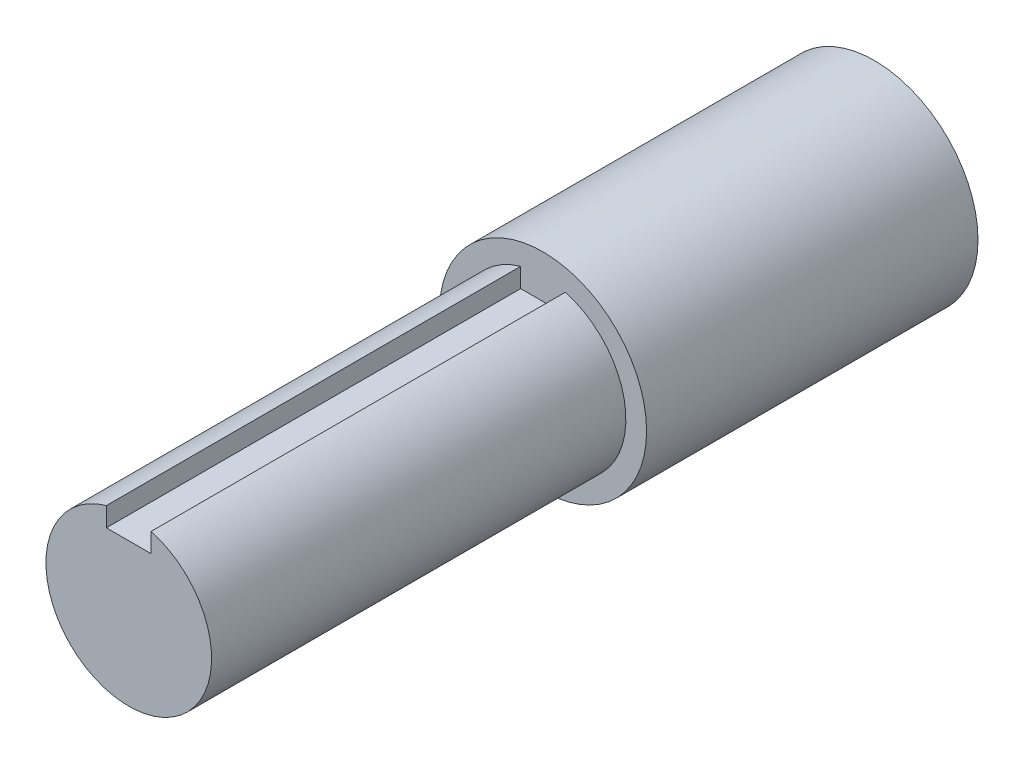
from build123d import *

# Parameters (mm, degrees)
SKETCH1_R           = 7.9375
BOSS_EXTRUDE1_DEPTH = 57.15
SKETCH2_R           = 3.8989
CUT_EXTRUDE1_DEPTH  = 31.75
SKETCH3_R           = 8.001
CUT_EXTRUDE2_DEPTH  = 31.75


with BuildPart() as part:
    # Sketch1 → Boss-Extrude1 (new body)
    with BuildSketch(Plane.XY):
        Circle(SKETCH1_R)
    extrude(amount=BOSS_EXTRUDE1_DEPTH)

    # Sketch2 → Cut-Extrude1 (cut)
    with BuildSketch(Plane(origin=(0, 0, 0), x_dir=(-1, 0, 0), z_dir=(0, 0, -1))):
        Circle(SKETCH2_R)
    extrude(amount=-CUT_EXTRUDE1_DEPTH, mode=Mode.SUBTRACT)

    # Sketch3 → Cut-Extrude2 (cut)
    with BuildSketch(Plane.XY.offset(57.15)):
        Circle(SKETCH3_R)
        with BuildLine():
            Line((-1.7145, 4.6355), (1.7145, 4.6355))
            Line((1.7145, 4.6355), (1.7145, 6.114163046))
            ThreePointArc((1.7145, 6.114163046), (0, -6.35), (-1.7145, 6.114163046))
            Line((-1.7145, 6.114163046), (-1.7145, 4.6355))
        make_face(mode=Mode.SUBTRACT)
    extrude(amount=-CUT_EXTRUDE2_DEPTH, mode=Mode.SUBTRACT)


solid = part.part
